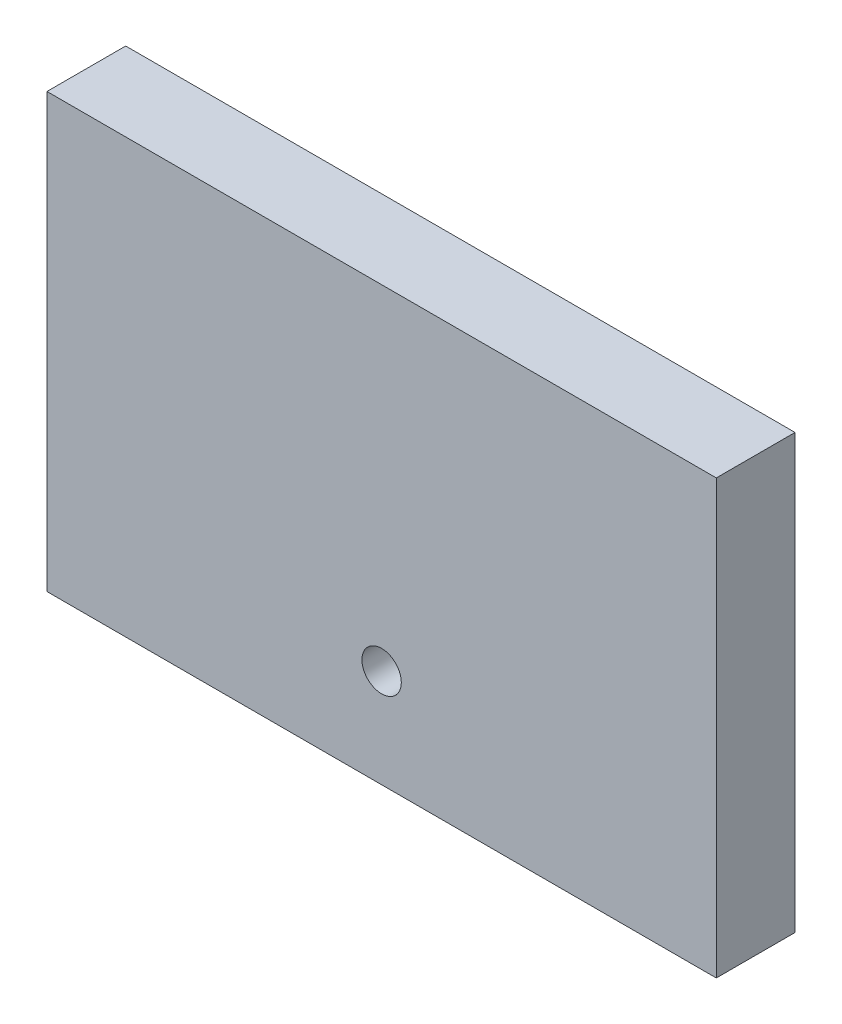
from build123d import *

# Parameters (mm, degrees)
ESQUISSE1_W             = 17
ESQUISSE1_H             = 11
BOSS_EXTRU_1_DEPTH      = 2
ESQUISSE2_R             = 0.5
ENL_V_MAT_EXTRU_2_DEPTH = 2


with BuildPart() as part:
    # Esquisse1 → Boss.-Extru.1 (new body)
    with BuildSketch(Plane.XY):
        with Locations((8.5, -5.5)):
            Rectangle(ESQUISSE1_W, ESQUISSE1_H)
    extrude(amount=BOSS_EXTRU_1_DEPTH)

    # Esquisse2 → Enlèv. mat.-Extru.2 (cut)
    with BuildSketch(Plane.XY.offset(2)):
        with Locations((8.5, -8.5)):
            Circle(ESQUISSE2_R)
    extrude(amount=-ENL_V_MAT_EXTRU_2_DEPTH, mode=Mode.SUBTRACT)


solid = part.part
